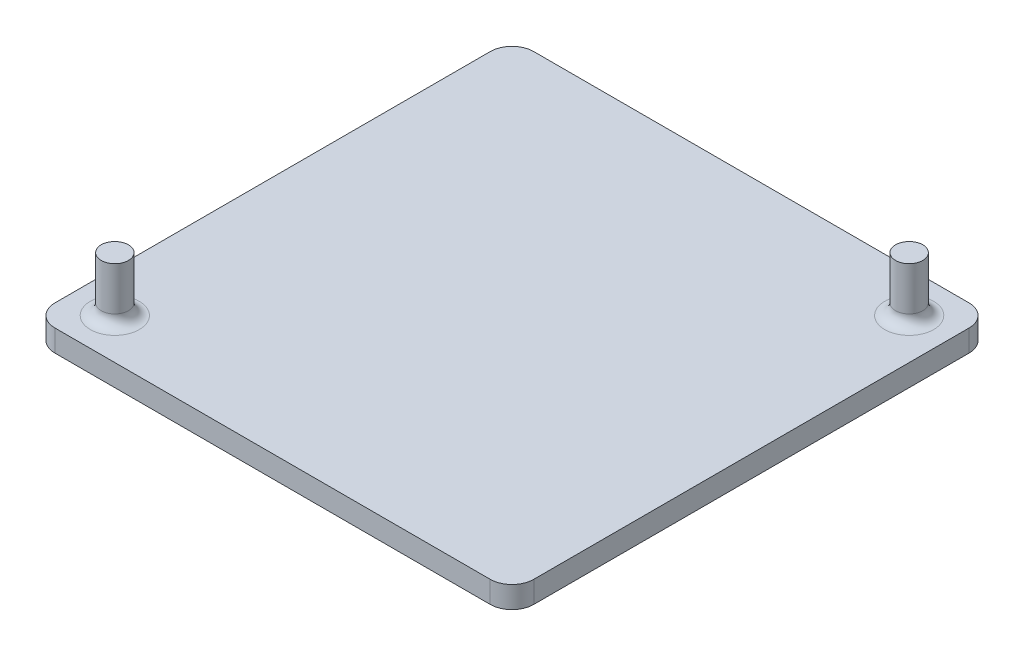
from build123d import *

# Parameters (mm, degrees)
SKETCH1_W           = 44
SKETCH1_H           = 44
BOSS_EXTRUDE1_DEPTH = 2
SKETCH2_R           = 1.25
BOSS_EXTRUDE4_DEPTH = 5
FILLET4_R           = 2
FILLET5_R           = 1


with BuildPart() as part:
    # Sketch1 → Boss-Extrude1 (new body)
    with BuildSketch(Plane(origin=(0, 0, 0), x_dir=(1, 0, 0), z_dir=(0, 1, 0))):
        with Locations((22, 22)):
            Rectangle(SKETCH1_W, SKETCH1_H)
    extrude(amount=BOSS_EXTRUDE1_DEPTH)

    # Sketch2 → Boss-Extrude4 (add)
    with BuildSketch(Plane(origin=(0, 2, 0), x_dir=(1, 0, 0), z_dir=(0, 1, 0))):
        with Locations(Location((3.75, 3.75, 0), (0, 0, 90))):
            Circle(SKETCH2_R)
        with Locations(Location((40.25, 40.25, 0), (0, 0, 90))):
            Circle(SKETCH2_R)
    extrude(amount=BOSS_EXTRUDE4_DEPTH)

    # Fillet4
    fillet4_edges = [part.edges().sort_by_distance(p)[0] for p in [
        (0, 1, -44),
        (44, 1, -44),
        (44, 1, 0),
        (0, 1, 0),
    ]]
    fillet(fillet4_edges, radius=FILLET4_R)

    # Fillet5
    fillet5_edges = [part.edges().sort_by_distance(p)[0] for p in [
        (40.25, 2, -39),
        (3.75, 2, -2.5),
    ]]
    fillet(fillet5_edges, radius=FILLET5_R)


solid = part.part
